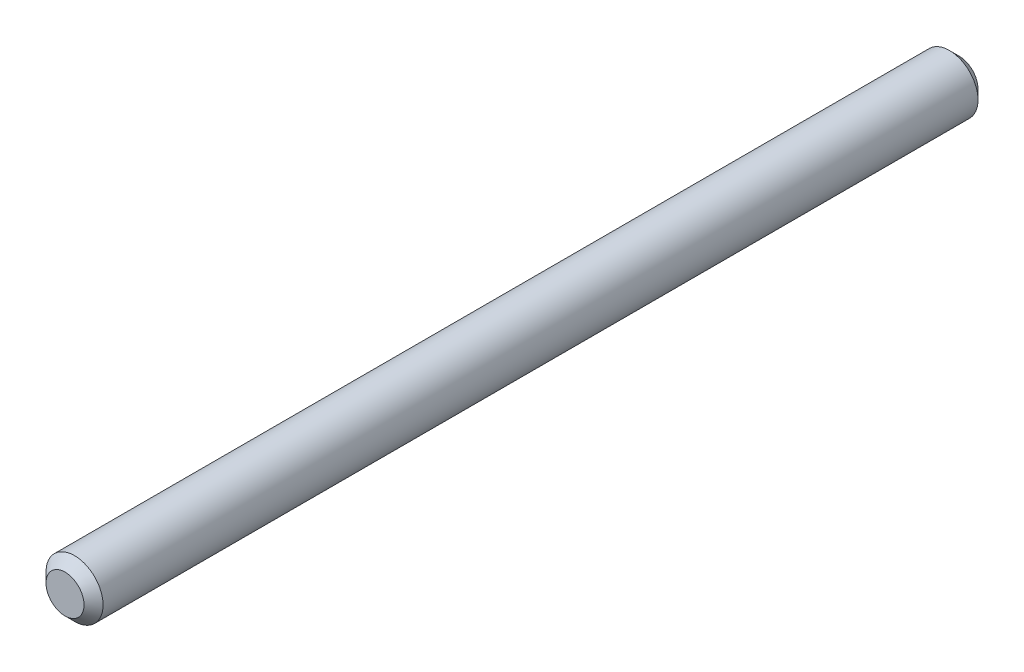
from build123d import *

# Parameters (mm, degrees)
BOSS_EXTRUDE1_DEPTH      = 40
BOSS_EXTRUDE1_DEPTH_BACK = 7
SKETCH1_R                = 1.5
CHAMFER1_SIZE            = 0.5
CUT_EXTRUDE1_DEPTH       = 1
CUT_EXTRUDE1_DEPTH_BACK  = 1
SKETCH2_R                = 1


with BuildPart() as part:
    # Sketch1 → Boss-Extrude1 (new, two sides: drawn at the far end of the back side and taken through both)
    with BuildSketch(Plane.XY.offset(-BOSS_EXTRUDE1_DEPTH_BACK)):
        Circle(SKETCH1_R)
    extrude(amount=BOSS_EXTRUDE1_DEPTH + BOSS_EXTRUDE1_DEPTH_BACK)

    # Chamfer1
    chamfer1_edges = [part.edges().sort_by_distance(p)[0] for p in [
        (-1.5, 0, 40),
        (-1.5, 0, -7),
    ]]
    chamfer(chamfer1_edges, length=CHAMFER1_SIZE)

    # Sketch2 → Cut-Extrude1 (cut, two sides: drawn at the far end of the back side and taken through both)
    with BuildSketch(Plane.XY.offset(16.5).offset(-CUT_EXTRUDE1_DEPTH_BACK)):
        Circle(SKETCH2_R)
    extrude(amount=CUT_EXTRUDE1_DEPTH + CUT_EXTRUDE1_DEPTH_BACK, mode=Mode.SUBTRACT)


solid = part.part
